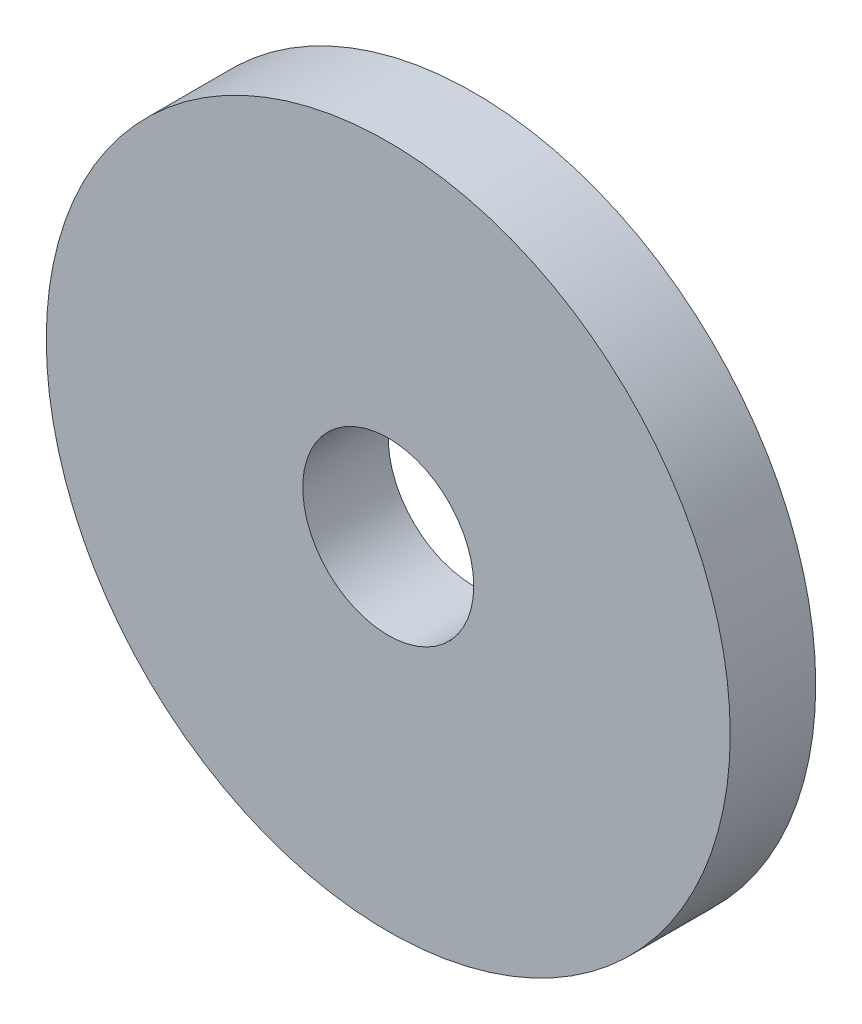
from build123d import *

# Parameters (mm, degrees)
SKETCH_1_R          = 20
EXTRUDE_1_DEPTH     = 5
SKETCH_2_R          = 5
CUT_EXTRUDE_1_DEPTH = 5


with BuildPart() as part:
    # ｽｹｯﾁ1 → ﾎﾞｽ - 押し出し1 (new body)
    with BuildSketch(Plane.XY):
        Circle(SKETCH_1_R)
    extrude(amount=EXTRUDE_1_DEPTH)

    # ｽｹｯﾁ2 → ｶｯﾄ - 押し出し1 (cut)
    with BuildSketch(Plane.XY.offset(5)):
        Circle(SKETCH_2_R)
    extrude(amount=-CUT_EXTRUDE_1_DEPTH, mode=Mode.SUBTRACT)


solid = part.part
